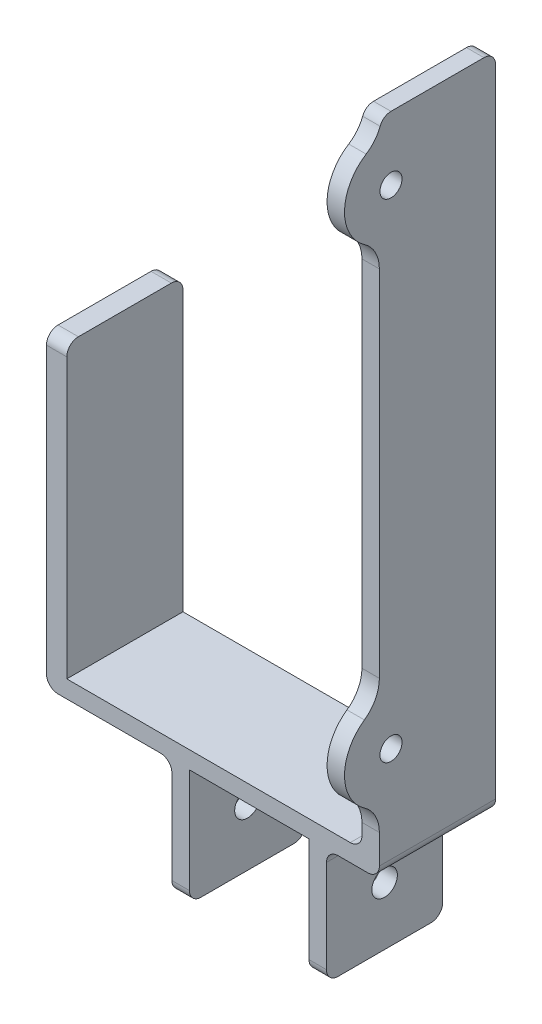
from build123d import *

# Parameters (mm, degrees)
BOSS_EXTRUDE1_DEPTH = 20
SKETCH2_R           = 2.2
CUT_EXTRUDE1_DEPTH  = 123.202659546
SKETCH3_R           = 8
BOSS_EXTRUDE2_DEPTH = 3
CUT_EXTRUDE2_REACH  = 129.16
SKETCH4_R           = 1.9
FILLET1_R           = 2
FILLET2_R           = 6


with BuildPart() as part:
    # Sketch1 → Boss-Extrude1 (new body)
    with BuildSketch(Plane.XY):
        Polygon((-25.4, 0), (25.4, 0), (25.4, 110.5), (28.4, 110.5), (28.4, -3), (19.3, -3), (19.3, -23), (16.3, -23), (16.3, -3), (-4.3, -3), (-4.3, -23), (-7.3, -23), (-7.3, -3), (-28.9, -3), (-28.9, 50), (-25.4, 50), align=None)
    extrude(amount=BOSS_EXTRUDE1_DEPTH)

    # Sketch2 → Cut-Extrude1 (cut, through all)
    with BuildSketch(Plane(origin=(19.3, 0, 0), x_dir=(0, 0, -1), z_dir=(1, 0, 0))):
        with Locations((-10, -13)):
            Circle(SKETCH2_R)
    extrude(amount=-CUT_EXTRUDE1_DEPTH, mode=Mode.SUBTRACT)

    # Sketch3 → Boss-Extrude2 (add)
    with BuildSketch(Plane(origin=(28.4, 0, 0), x_dir=(0, 0, -1), z_dir=(1, 0, 0))):
        with Locations((-18, 99.5)):
            Circle(SKETCH3_R)
        with Locations((-18, 15.5)):
            Circle(SKETCH3_R)
    extrude(amount=-BOSS_EXTRUDE2_DEPTH)

    # Sketch4 → Cut-Extrude2 (cut, up to next)
    with BuildSketch(Plane(origin=(28.4, 0, 0), x_dir=(0, 0, -1), z_dir=(1, 0, 0)), mode=Mode.PRIVATE) as cut_extrude2_sk1:
        with Locations(Location((-18, 99.5, 0), (0, 0, 90))):
            Circle(SKETCH4_R)
    cut_extrude2_tool1 = extrude(cut_extrude2_sk1.sketch, amount=-CUT_EXTRUDE2_REACH, mode=Mode.PRIVATE) & part.part
    # Sketch4 → Cut-Extrude2 (cut, up to next)
    with BuildSketch(Plane(origin=(28.4, 0, 0), x_dir=(0, 0, -1), z_dir=(1, 0, 0)), mode=Mode.PRIVATE) as cut_extrude2_sk2:
        with Locations(Location((-18, 15.5, 0), (0, 0, 90))):
            Circle(SKETCH4_R)
    cut_extrude2_tool2 = extrude(cut_extrude2_sk2.sketch, amount=-CUT_EXTRUDE2_REACH, mode=Mode.PRIVATE) & part.part
    add(cut_extrude2_tool1.solids().sort_by_distance((28.4, 99.5, 18))[0], mode=Mode.SUBTRACT)
    add(cut_extrude2_tool2.solids().sort_by_distance((28.4, 15.5, 18))[0], mode=Mode.SUBTRACT)

    # Fillet1
    fillet1_edges = [part.edges().sort_by_distance(p)[0] for p in [
        (26.9, 110.5, 0),
        (17.8, -23, 0),
        (-5.8, -23, 0),
        (-5.8, -23, 20),
        (-27.15, 50, 0),
        (25.4, 0, 10),
        (28.4, -3, 10),
        (19.3, -3, 10),
        (-7.3, -3, 10),
        (-28.9, -3, 10),
        (17.8, -23, 20),
        (26.9, 110.5, 20),
        (-27.15, 50, 20),
    ]]
    fillet(fillet1_edges, radius=FILLET1_R)

    # Fillet2
    fillet2_edges = [part.edges().sort_by_distance(p)[0] for p in [
        (26.9, 91.754033308, 20),
        (26.9, 107.245966692, 20),
        (26.9, 7.754033308, 20),
        (26.9, 23.245966692, 20),
    ]]
    fillet(fillet2_edges, radius=FILLET2_R)


solid = part.part
